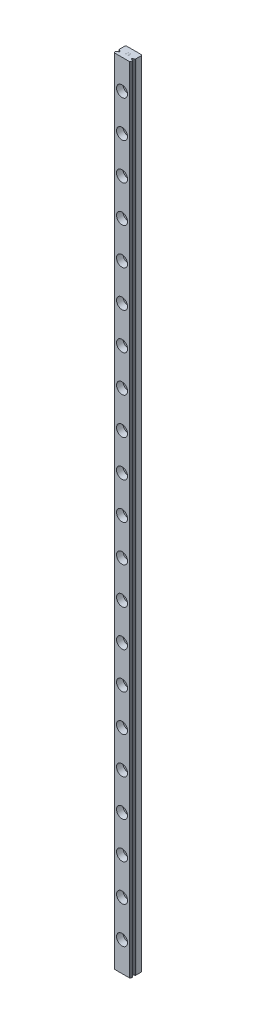
from build123d import *

# Parameters (mm, degrees)
SALIENTE_EXTRUIR1_DEPTH = 432
CORTAR_EXTRUIR1_DEPTH   = 433.072331908
CORTAR_EXTRUIR2_DEPTH   = 433.072331908
CORTAR_EXTRUIR3_DEPTH   = 433.072331908
CORTAR_EXTRUIR4_DEPTH   = 433.072331908
CORTAR_EXTRUIR5_DEPTH   = 433.072331908
CORTAR_EXTRUIR6_DEPTH   = 433.072331908
CORTAR_EXTRUIR7_DEPTH   = 0.002166667
CORTAR_EXTRUIR8_DEPTH   = 0.002166667
CORTAR_EXTRUIR9_DEPTH   = 0.002166667
CORTAR_EXTRUIR10_DEPTH  = 0.002166667
NGULO_DE_SALIDA1_ANGLE  = 45.1469538
CHAFL_N1_SIZE           = 0.4
REDONDEO1_R             = 0.130000023
MATRIZL2_COUNT          = 21
MATRIZL2_PITCH          = 20


with BuildPart() as part:
    # Croquis1 → Saliente-Extruir1 (new body)
    with BuildSketch(Plane.XZ):
        Polygon((4.5, 0), (4.5, 6.01167813), (4.1, 6.50000002), (-4.1, 6.50000002), (-4.5, 6.01167813), (-4.5, 0), align=None)
    extrude(amount=-SALIENTE_EXTRUIR1_DEPTH)

    # Croquis2 → Cortar-Extruir1 (cut, through all)
    with BuildSketch(Plane(origin=(0, 432, 0), x_dir=(-1, 0, 0), z_dir=(0, 1, 0))):
        with BuildLine():
            Line((-4.5, 4.88017535), (-4.5, 4.03150278))
            Line((-4.5, 4.03150278), (-3.819258765, 4.03150278))
            ThreePointArc((-3.819258765, 4.03150278), (-3.21946318, 4.455839065), (-3.819258765, 4.88017535))
            Line((-3.819258765, 4.88017535), (-4.5, 4.88017535))
        make_face()
    extrude(amount=-CORTAR_EXTRUIR1_DEPTH, mode=Mode.SUBTRACT)

    # Croquis3 → Cortar-Extruir2 (cut, through all)
    with BuildSketch(Plane(origin=(0, 432, 0), x_dir=(-1, 0, 0), z_dir=(0, 1, 0))):
        with BuildLine():
            Line((-4.026513856, 4.03150278), (-4.5, 4.03150278))
            Line((-4.5, 4.03150278), (-4.5, 3.583620931))
            ThreePointArc((-4.5, 3.583620931), (-4.223645982, 3.76568645), (-4.026513856, 4.03150278))
        make_face()
    extrude(amount=-CORTAR_EXTRUIR2_DEPTH, mode=Mode.SUBTRACT)

    # Croquis4 → Cortar-Extruir3 (cut, through all)
    with BuildSketch(Plane(origin=(0, 432, 0), x_dir=(-1, 0, 0), z_dir=(0, 1, 0))):
        with BuildLine():
            Line((-4.5, 5.328056964), (-4.5, 4.88017535))
            Line((-4.5, 4.88017535), (-4.026513974, 4.88017535))
            ThreePointArc((-4.026513974, 4.88017535), (-4.223646078, 5.145991535), (-4.5, 5.328056964))
        make_face()
    extrude(amount=-CORTAR_EXTRUIR3_DEPTH, mode=Mode.SUBTRACT)

    # Croquis5 → Cortar-Extruir4 (cut, through all)
    with BuildSketch(Plane(origin=(0, 432, 0), x_dir=(-1, 0, 0), z_dir=(0, 1, 0))):
        with BuildLine():
            Line((4.5, 4.03150278), (4.5, 4.88017535))
            Line((4.5, 4.88017535), (3.819258765, 4.88017535))
            ThreePointArc((3.819258765, 4.88017535), (3.21946318, 4.455839065), (3.819258765, 4.03150278))
            Line((3.819258765, 4.03150278), (4.5, 4.03150278))
        make_face()
    extrude(amount=-CORTAR_EXTRUIR4_DEPTH, mode=Mode.SUBTRACT)

    # Croquis6 → Cortar-Extruir5 (cut, through all)
    with BuildSketch(Plane(origin=(0, 432, 0), x_dir=(-1, 0, 0), z_dir=(0, 1, 0))):
        with BuildLine():
            Line((4.026513826, 4.88017535), (4.5, 4.88017535))
            Line((4.5, 4.88017535), (4.5, 5.328057255))
            ThreePointArc((4.5, 5.328057255), (4.223645966, 5.145991706), (4.026513826, 4.88017535))
        make_face()
    extrude(amount=-CORTAR_EXTRUIR5_DEPTH, mode=Mode.SUBTRACT)

    # Croquis7 → Cortar-Extruir6 (cut, through all)
    with BuildSketch(Plane(origin=(0, 432, 0), x_dir=(-1, 0, 0), z_dir=(0, 1, 0))):
        with BuildLine():
            Line((4.5, 3.583620926), (4.5, 4.03150278))
            Line((4.5, 4.03150278), (4.026513851, 4.03150278))
            ThreePointArc((4.026513851, 4.03150278), (4.223645987, 3.765686455), (4.5, 3.583620926))
        make_face()
    extrude(amount=-CORTAR_EXTRUIR6_DEPTH, mode=Mode.SUBTRACT)

    # Croquis8 → Cortar-Extruir7 (cut)
    with BuildSketch(Plane(origin=(0, 432, 0), x_dir=(-1, 0, 0), z_dir=(0, 1, 0))):
        Polygon((0.891369267, 3.403698133), (0.714701433, 3.168235633), (0.2187042, 2.61105), (1.0945792, 2.61105), (1.0945792, 2.695983333), (0.398689633, 2.695983333), (0.794326433, 3.149466667), (0.9743123, 3.3891), (1.067110588, 3.573407857), (0.95413722, 3.802321701), (0.7876908, 3.88505), (0.54301, 3.88505), (0.375434678, 3.803592619), (0.295011167, 3.6384023), (0.295011167, 3.562), (0.3812718, 3.562), (0.3812718, 3.631766667), (0.437672733, 3.743620833), (0.549645633, 3.800116667), (0.7802262, 3.800116667), (0.893028067, 3.743810633), (0.976240026, 3.576039029), align=None)
    extrude(amount=-CORTAR_EXTRUIR7_DEPTH, mode=Mode.SUBTRACT)

    # Croquis9 → Cortar-Extruir8 (cut)
    with BuildSketch(Plane.XZ):
        Polygon((-0.214632167, 3.88505), (-0.953983333, 3.88505), (-0.953983333, 2.61105), (-0.214632167, 2.61105), (-0.214632167, 2.695983333), (-0.86905, 2.695983333), (-0.86905, 3.205583333), (-0.5123963, 3.205583333), (-0.5123963, 3.290516667), (-0.86905, 3.290516667), (-0.86905, 3.800116667), (-0.214632167, 3.800116667), align=None)
    extrude(amount=-CORTAR_EXTRUIR8_DEPTH, mode=Mode.SUBTRACT)

    # Croquis10 → Cortar-Extruir9 (cut)
    with BuildSketch(Plane(origin=(0, 432, 0), x_dir=(-1, 0, 0), z_dir=(0, 1, 0))):
        Polygon((-0.214632167, 3.88505), (-0.953983333, 3.88505), (-0.953983333, 2.61105), (-0.214632167, 2.61105), (-0.214632167, 2.695983333), (-0.86905, 2.695983333), (-0.86905, 3.205583333), (-0.5123963, 3.205583333), (-0.5123963, 3.290516667), (-0.86905, 3.290516667), (-0.86905, 3.800116667), (-0.214632167, 3.800116667), align=None)
    extrude(amount=-CORTAR_EXTRUIR9_DEPTH, mode=Mode.SUBTRACT)

    # Croquis11 → Cortar-Extruir10 (cut)
    with BuildSketch(Plane.XZ):
        Polygon((0.510057167, 3.620830633), (0.6071, 3.718655633), (0.6071, 2.609403333), (0.692033333, 2.609403333), (0.692033333, 3.883403333), (0.6741176, 3.883403333), (0.6741176, 3.795069794), (0.3690544, 3.640736667), (0.3690544, 3.551253333), align=None)
    extrude(amount=-CORTAR_EXTRUIR10_DEPTH, mode=Mode.SUBTRACT)

    # Ángulo de salida1
    ngulo_de_salida1_faces = [part.faces().sort_by_distance(p)[0] for p in [
        (0.6741176, 0.001083333, 3.839236564),
    ]]
    draft(ngulo_de_salida1_faces, Plane(origin=(0.692033333, 0.002166667, 3.883403333), x_dir=(-1, 0, 0), z_dir=(0, 0, -1)), NGULO_DE_SALIDA1_ANGLE)

    # Chaflán1
    chafl_n1_edges = [part.edges().sort_by_distance(p)[0] for p in [
        (-4.5, 216, 0),
        (4.5, 216, 0),
    ]]
    chamfer(chafl_n1_edges, length=CHAFL_N1_SIZE)

    # Redondeo1
    redondeo1_edges = [part.edges().sort_by_distance(p)[0] for p in [
        (4.026513856, 216, 4.03150278),
        (4.5, 216, 3.583620931),
        (4.5, 216, 5.328056964),
        (4.026513974, 216, 4.88017535),
        (-4.026513826, 216, 4.88017535),
        (-4.5, 216, 5.328057255),
        (-4.5, 216, 3.583620926),
        (-4.026513851, 216, 4.03150278),
    ]]
    fillet(redondeo1_edges, radius=REDONDEO1_R)

    # Croquis34 → Taladro roscado M3.5x0.61 (revolve, cut)
    with BuildSketch(Plane(origin=(0, 16, 0), x_dir=(0, 1, 0), z_dir=(1, 0, 0))):
        Polygon((0, 0), (0, 8), (3, 8), (3, 3), (1.75, 3), (1.75, 0), align=None)
    taladro_roscado_m3_5x0_61 = revolve(axis=Axis((0, 16, -6.35), (0, 0, 1)), mode=Mode.SUBTRACT)

    # MatrizL2: Taladro roscado M3.5x0.61 ×21
    with Locations(*[(0, i * MATRIZL2_PITCH, 0) for i in range(1, MATRIZL2_COUNT)]):
        add(taladro_roscado_m3_5x0_61, mode=Mode.SUBTRACT)


solid = part.part
